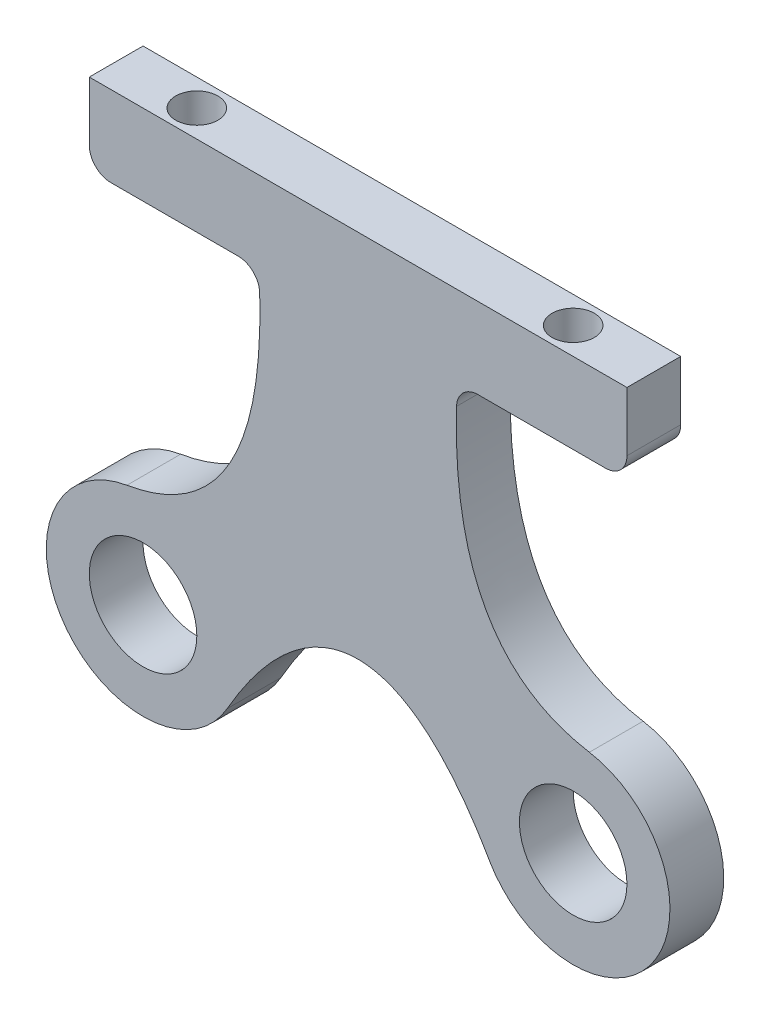
from build123d import *

# Parameters (mm, degrees)
SKETCH1_R                  = 11.43
SKETCH1_R_2                = 6.35
BOSS_EXTRUDE1_DEPTH        = 3.175
FILLET1_R                  = 2.54
F_10_CLEARANCE_HOLE1_D     = 4.9784
F_10_CLEARANCE_HOLE1_DEPTH = 9.525


with BuildPart() as part:
    # Sketch1 → Boss-Extrude1 (new, symmetric)
    # profile 1 of 3: a face of its own
    with BuildSketch(Plane.XY):
        with BuildLine():
            Line((31.75, -9.525), (31.75, 0))
            Line((31.75, 0), (-31.75, 0))
            Line((-31.75, 0), (-31.75, -9.525))
            Line((-31.75, -9.525), (-11.736070368, -9.525))
            add(Edge.make_bspline(
                [(-27.309712652, -39.53066561), (-10.121441585, -36.617924041), (-11.736070368, -9.525)],
                knots=[0, 0, 0, 1, 1, 1], degree=2))
            ThreePointArc((-27.309712652, -39.53066561), (-18.023792154, -42.06865086), (-13.97, -50.8))
            ThreePointArc((-13.97, -50.8), (-14.353544724, -53.736107258), (-15.478438466, -56.47516667))
            add(Edge.make_bspline(
                [(-15.478438466, -56.47516667), (-5.067830393, -38.274910251), (6.38081654, -40.57032704), (15.478438466, -56.47516667)],
                knots=[0, 0, 0, 0, 1, 1, 1, 1], degree=3))
            ThreePointArc((15.478438466, -56.47516667), (16.028422776, -44.256419914), (27.309712652, -39.53066561))
            add(Edge.make_bspline(
                [(27.309712652, -39.53066561), (10.121441585, -36.617924041), (11.736070368, -9.525)],
                knots=[0, 0, 0, 1, 1, 1], degree=2))
            Line((11.736070368, -9.525), (31.75, -9.525))
        make_face()
    # profile 2 of 3: a face of its own
    with BuildSketch(Plane.XY):
        with Locations((-25.4, -50.8)):
            Circle(SKETCH1_R)
        with Locations((-25.4, -50.8)):
            Circle(SKETCH1_R_2, mode=Mode.SUBTRACT)
    # profile 3 of 3: a face of its own
    with BuildSketch(Plane.XY):
        with Locations((25.4, -50.8)):
            Circle(SKETCH1_R)
        with Locations((25.4, -50.8)):
            Circle(SKETCH1_R_2, mode=Mode.SUBTRACT)
    extrude(amount=BOSS_EXTRUDE1_DEPTH, both=True)

    # Fillet1
    fillet1_edges = [part.edges().sort_by_distance(p)[0] for p in [
        (-11.736070368, -9.525, -1.5875),
        (-31.75, -9.525, 0),
        (31.75, -9.525, 0),
        (11.736070368, -9.525, 1.5875),
    ]]
    fillet(fillet1_edges, radius=FILLET1_R)

    # #10 Clearance Hole1
    with Locations(Plane(origin=(0, -9.525, 0), x_dir=(-1, 0, 0), z_dir=(0, -1, 0))):
        with Locations((22.225, 0), (-22.225, 0)):
            Hole(F_10_CLEARANCE_HOLE1_D / 2, depth=F_10_CLEARANCE_HOLE1_DEPTH)


solid = part.part
